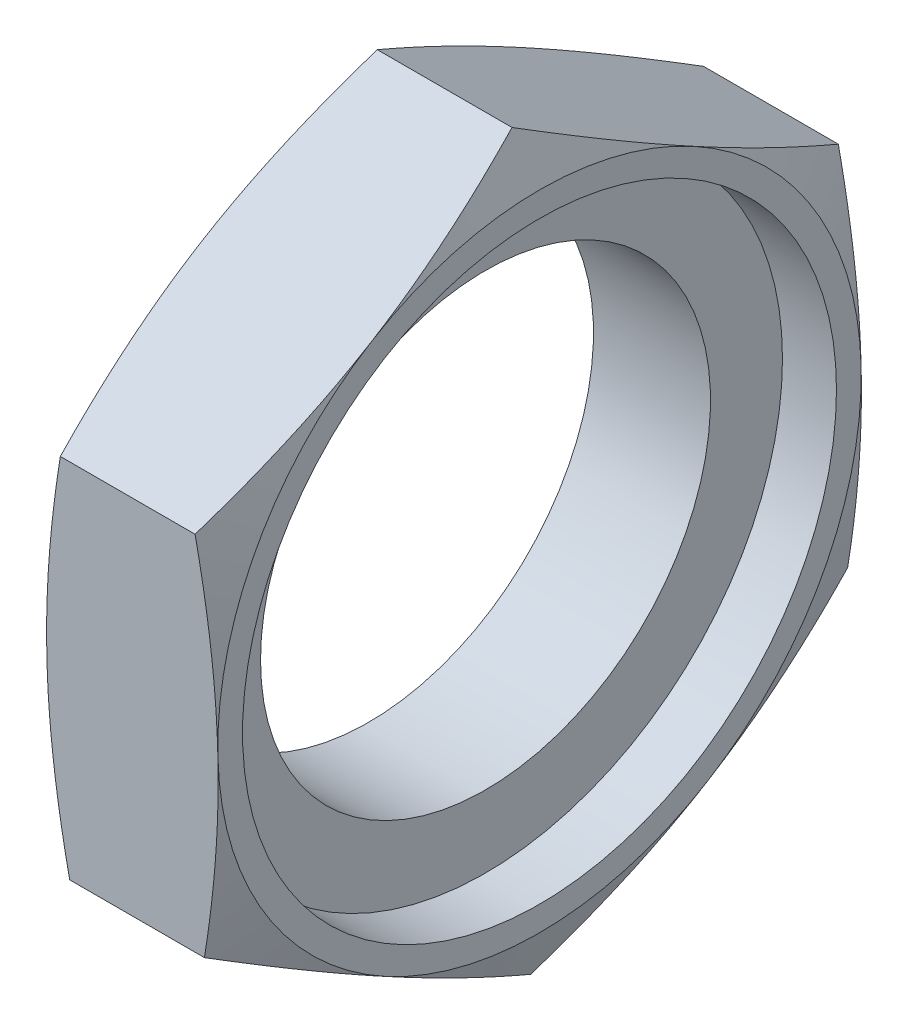
from build123d import *

# Parameters (mm, degrees)
ESBO_O1_R                = 10
RESSALTO_EXTRUS_O1_DEPTH = 7.6
FURO1_D                  = 26.4
FURO1_DEPTH              = 2.4
ESBO_O7_OUTSIDE_W        = 111.36
ESBO_O7_OUTSIDE_H        = 115.368
ESBO_O7_OUTSIDE_R        = 14.3
CORTE_EXTRUS_O1_DEPTH    = 13
CORTE_EXTRUS_O1_DRAFT    = -70
ESBO_O8_OUTSIDE_W        = 111.36
ESBO_O8_OUTSIDE_H        = 115.368
ESBO_O8_OUTSIDE_R        = 14.3
CORTE_EXTRUS_O2_DEPTH    = 13
CORTE_EXTRUS_O2_DRAFT    = -70


with BuildPart() as part:
    # Esboço1 → Ressalto-extrusão1 (new body)
    with BuildSketch(Plane(origin=(0, 0, 0), x_dir=(0, 0, -1), z_dir=(1, 0, 0))):
        Polygon((14.087474947, 8.613732232), (-0.415973461, 16.506977295), (-14.503448407, 7.893245063), (-14.087474947, -8.613732232), (0.415973461, -16.506977295), (14.503448407, -7.893245063), align=None)
        with Locations(Location((0, 0, 0), (0, 0, 180))):
            Circle(ESBO_O1_R, mode=Mode.SUBTRACT)
    extrude(amount=RESSALTO_EXTRUS_O1_DEPTH)

    # Furo1
    with Locations(Plane(origin=(7.6, 0, 0), x_dir=(0, 0, -1), z_dir=(1, 0, 0))):
        with Locations((0, 0)):
            Hole(FURO1_D / 2, depth=FURO1_DEPTH)


with BuildPart() as corte_extrus_o1_tool:
    # Esboço7 outside → Corte-extrusão1 (with draft: the straight prism first)
    with BuildSketch(Plane(origin=(7.6, 0, 0), x_dir=(0, 0, -1), z_dir=(1, 0, 0))):
        Rectangle(ESBO_O7_OUTSIDE_W, ESBO_O7_OUTSIDE_H)
        Circle(ESBO_O7_OUTSIDE_R, mode=Mode.SUBTRACT)
    extrude(amount=-CORTE_EXTRUS_O1_DEPTH)
    # Corte-extrusão1: the draft: its side faces are tilted about the plane it starts from
    corte_extrus_o1_sides = [corte_extrus_o1_tool.faces().sort_by_distance(p)[0] for p in [
        (1.1, -57.684, 0),
        (1.1, 0, -55.68),
        (1.1, 57.684, 0),
        (1.1, 0, 55.68),
        (1.1, 0, 14.3),
    ]]
    draft(corte_extrus_o1_sides, Plane(origin=(7.6, 0, 0), x_dir=(0, 0, -1), z_dir=(1, 0, 0)), CORTE_EXTRUS_O1_DRAFT)


with BuildPart() as part_1:
    add(part.part)

    # Corte-extrusão1: cut by corte_extrus_o1_tool
    add(corte_extrus_o1_tool.part, mode=Mode.SUBTRACT)


with BuildPart() as corte_extrus_o2_tool:
    # Esboço8 outside → Corte-extrusão2 (with draft: the straight prism first)
    with BuildSketch(Plane.ZY):
        Rectangle(ESBO_O8_OUTSIDE_W, ESBO_O8_OUTSIDE_H)
        Circle(ESBO_O8_OUTSIDE_R, mode=Mode.SUBTRACT)
    extrude(amount=-CORTE_EXTRUS_O2_DEPTH)
    # Corte-extrusão2: the draft: its side faces are tilted about the plane it starts from
    corte_extrus_o2_sides = [corte_extrus_o2_tool.faces().sort_by_distance(p)[0] for p in [
        (6.5, -57.684, 0),
        (6.5, 0, 55.68),
        (6.5, 57.684, 0),
        (6.5, 0, -55.68),
        (6.5, 0, -14.3),
    ]]
    draft(corte_extrus_o2_sides, Plane.ZY, CORTE_EXTRUS_O2_DRAFT)


with BuildPart() as part_2:
    add(part_1.part)

    # Corte-extrusão2: cut by corte_extrus_o2_tool
    add(corte_extrus_o2_tool.part, mode=Mode.SUBTRACT)


solid = part_2.part
